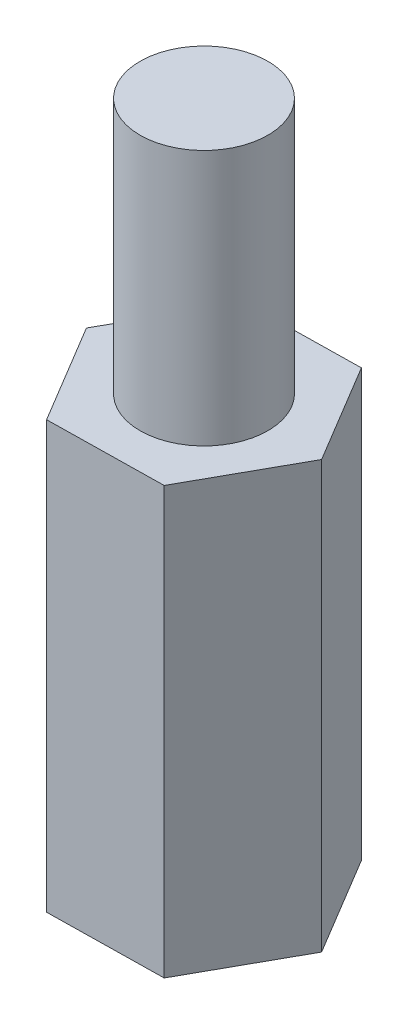
from build123d import *

# Parameters (mm, degrees)
SKETCH_1_R      = 1.5
EXTRUDE_1_DEPTH = 10
SKETCH_2_R      = 1.5
EXTRUDE_2_DEPTH = 6


with BuildPart() as part:
    # 草图1 → 凸台-拉伸1 (new body)
    with BuildSketch(Plane(origin=(0, 0, 0), x_dir=(1, 0, 0), z_dir=(0, 1, 0))):
        Polygon((1.394530192, -2.327792705), (2.713192713, 0.04380222), (1.318662521, 2.371594925), (-1.394530192, 2.327792705), (-2.713192713, -0.04380222), (-1.318662521, -2.371594925), align=None)
        with Locations(Location((0, 0, 0), (0, 0, 270))):
            Circle(SKETCH_1_R, mode=Mode.SUBTRACT)
    extrude(amount=EXTRUDE_1_DEPTH)


with BuildPart() as body_2:
    # 草图2 → 凸台-拉伸2 (new body)
    with BuildSketch(Plane(origin=(0, 10, 0), x_dir=(1, 0, 0), z_dir=(0, 1, 0))):
        with Locations(Location((0, 0, 0), (0, 0, 270))):
            Circle(SKETCH_2_R)
    extrude(amount=EXTRUDE_2_DEPTH)


solid = Compound([part.part, body_2.part])
